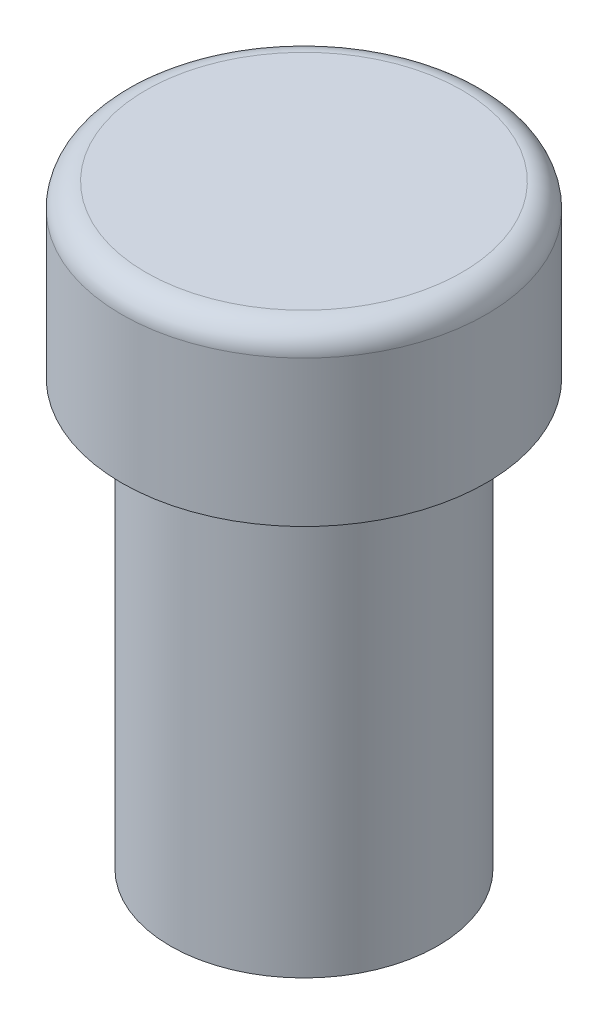
from build123d import *

# Parameters (mm, degrees)
SKETCH_1_R      = 11
EXTRUDE_1_DEPTH = 35
SKETCH_2_R      = 15
EXTRUDE_2_DEPTH = 14
FILLET_1_R      = 2


with BuildPart() as part:
    # Эскиз1 → Вытянуть1 (new body)
    with BuildSketch(Plane(origin=(0, 0, 0), x_dir=(1, 0, 0), z_dir=(0, 1, 0))):
        with Locations(Location((0, 0, 0), (0, 0, 270))):
            Circle(SKETCH_1_R)
    extrude(amount=EXTRUDE_1_DEPTH)

    # Эскиз2 → Вытянуть2 (add)
    with BuildSketch(Plane(origin=(0, 35, 0), x_dir=(1, 0, 0), z_dir=(0, 1, 0))):
        with Locations(Location((0, 0, 0), (0, 0, 270))):
            Circle(SKETCH_2_R)
    extrude(amount=EXTRUDE_2_DEPTH)

    # Скругление1
    fillet_1_edges = [part.edges().sort_by_distance(p)[0] for p in [
        (0, 49, -15),
    ]]
    fillet(fillet_1_edges, radius=FILLET_1_R)


solid = part.part
